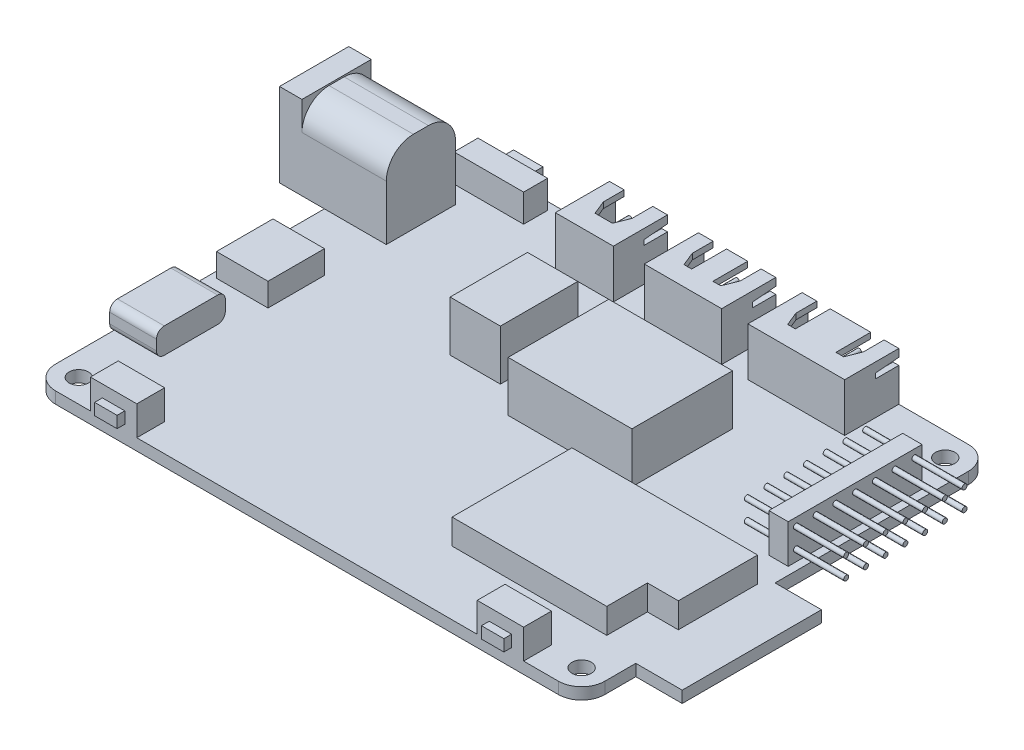
from build123d import *

# Parameters (mm, degrees)
SKETCH_2_W                  = 71
SKETCH_2_H                  = 53
SKETCH_2_W_2                = 6
SKETCH_2_H_2                = 18
EXTRUDE_1_DEPTH             = 1.5
FILLET_1_R                  = 3
SKETCH_3_W                  = 10
SKETCH_3_H                  = 7
SKETCH_3_W_2                = 12.5
SKETCH_3_W_3                = 7.5
EXTRUDE_2_DEPTH             = 6.25
SKETCH_3_3_W                = 16
SKETCH_3_3_H                = 13
SKETCH_3_3_W_2              = 6.5
SKETCH_3_3_H_2              = 10
EXTRUDE_3_DEPTH             = 6.5
SKETCH_3_4_W                = 20
SKETCH_3_4_H                = 15.5
SKETCH_3_4_W_2              = 4
SKETCH_3_4_H_2              = 10.25
EXTRUDE_4_DEPTH             = 3.25
CUT_EXTRUDE_1_REACH         = 60.863
SKETCH_3_5_R                = 1.25
SKETCH_3_6_W                = 2.5
SKETCH_3_6_H                = 17.3
EXTRUDE_5_DEPTH             = 5
SKETCH_3_7_W                = 6.05
SKETCH_3_7_H                = 8.9
EXTRUDE_6_DEPTH             = 3.3
SKETCH_3_8_W                = 6
SKETCH_3_8_H                = 3.6
EXTRUDE_7_DEPTH             = 3.8
SKETCH_3_9_W                = 6.66
SKETCH_3_9_H                = 7.3
EXTRUDE_8_DEPTH             = 3
SKETCH_3_10_W               = 8
SKETCH_3_10_H               = 8.95
SKETCH_3_10_W_2             = 5.8
EXTRUDE_9_DEPTH             = 10.6
SKETCH_3_11_W               = 9
SKETCH_3_11_H               = 3.1
EXTRUDE_10_DEPTH            = 3.6
FILLET_2_R                  = 1
FILLET_3_R                  = 3.5
SKETCH_8_W                  = 8.95
SKETCH_8_H                  = 10.8
EXTRUDE_11_DEPTH            = 2.9
SKETCH_8_7_R                = 3
SKETCH_8_7_R_2              = 0.75
CUT_EXTRUDE_2_DEPTH         = 10
FILLET_6_R                  = 0.75
SKETCH_9_W                  = 2.9
SKETCH_9_H                  = 1.5
EXTRUDE_12_DEPTH            = 1
CUT_EXTRUDE_3_DEPTH         = 5
FILLET_7_R                  = 0.2
SKETCH_12_W                 = 8.5
SKETCH_12_H                 = 4.75
SKETCH_12_R                 = 0.3
SKETCH_12_W_2               = 6
SKETCH_12_W_3               = 11
CUT_EXTRUDE_4_DEPTH         = 5.5
CUT_EXTRUDE_5_DEPTH         = 40
SKETCH_14_W                 = 0.24
SKETCH_14_H                 = 4.5
CUT_EXTRUDE_6_DEPTH         = 0.75
EXTRUDE_START               = -6.35
SKETCH_16_R                 = 0.325
EXTRUDE_13_DEPTH            = 12.85
PATTERN_LINEAR_1_COUNT      = 7
PATTERN_LINEAR_1_PITCH      = 2.55
PATTERN_LINEAR_1_COUNT_DIR2 = 2
PATTERN_LINEAR_1_PITCH_DIR2 = 2.55
EXTRUDE_14_DEPTH            = 0.2
EXTRUDE_15_DEPTH            = 2.8
SKETCH_19_W                 = 3.8
SKETCH_19_H                 = 1.55
EXTRUDE_16_DEPTH            = 2


with BuildPart() as part:
    # 草图2 → 凸台-拉伸1 (new body)
    with BuildSketch(Plane(origin=(0, 0, 0), x_dir=(1, 0, 0), z_dir=(0, 1, 0))):
        with Locations((10.067073171, 1.131097561)):
            Rectangle(SKETCH_2_W, SKETCH_2_H)
        with Locations((48.567073171, -9.368902439)):
            Rectangle(SKETCH_2_W_2, SKETCH_2_H_2)
    extrude(amount=EXTRUDE_1_DEPTH)

    # 圆角1
    fillet_1_edges = [part.edges().sort_by_distance(p)[0] for p in [
        (45.567073171, 0.75, 25.368902439),
        (-25.432926829, 0.75, 25.368902439),
        (-25.432926829, 0.75, -27.631097561),
        (45.567073171, 0.75, -27.631097561),
    ]]
    fillet(fillet_1_edges, radius=FILLET_1_R)

    # 草图3 → 凸台-拉伸2 (add)
    with BuildSketch(Plane(origin=(0, 1.5, 0), x_dir=(1, 0, 0), z_dir=(0, 1, 0))):
        with Locations((12.667073171, 24.131097561)):
            Rectangle(SKETCH_3_W, SKETCH_3_H)
        with Locations((27.317073171, 24.131097561)):
            Rectangle(SKETCH_3_W_2, SKETCH_3_H)
        with Locations((-0.082926829, 24.131097561)):
            Rectangle(SKETCH_3_W_3, SKETCH_3_H)
    extrude(amount=EXTRUDE_2_DEPTH)

    # 草图3<3> → 凸台-拉伸3 (add)
    with BuildSketch(Plane(origin=(0, 1.5, 0), x_dir=(1, 0, 0), z_dir=(0, 1, 0))):
        with Locations((17.567073171, 7.631097561)):
            Rectangle(SKETCH_3_3_W, SKETCH_3_3_H)
        with Locations((2.317073171, 9.131097561)):
            Rectangle(SKETCH_3_3_W_2, SKETCH_3_3_H_2)
    extrude(amount=EXTRUDE_3_DEPTH)

    # 草图3<4> → 凸台-拉伸4 (add)
    with BuildSketch(Plane(origin=(0, 1.5, 0), x_dir=(1, 0, 0), z_dir=(0, 1, 0))):
        with Locations((30.567073171, -9.368902439)):
            Rectangle(SKETCH_3_4_W, SKETCH_3_4_H)
        with Locations((42.567073171, -6.743902439)):
            Rectangle(SKETCH_3_4_W_2, SKETCH_3_4_H_2)
    extrude(amount=EXTRUDE_4_DEPTH)

    # 草图3<5> → 切除-拉伸1 (cut, up to next)
    with BuildSketch(Plane(origin=(0, 1.5, 0), x_dir=(1, 0, 0), z_dir=(0, 1, 0)), mode=Mode.PRIVATE) as cut_extrude_1_sk1:
        with Locations(Location((-22.432926829, 24.631097561, 0), (0, 0, 270))):
            Circle(SKETCH_3_5_R)
    cut_extrude_1_tool1 = extrude(cut_extrude_1_sk1.sketch, amount=-CUT_EXTRUDE_1_REACH, mode=Mode.PRIVATE) & part.part
    # 草图3<5> → 切除-拉伸1 (cut, up to next)
    with BuildSketch(Plane(origin=(0, 1.5, 0), x_dir=(1, 0, 0), z_dir=(0, 1, 0)), mode=Mode.PRIVATE) as cut_extrude_1_sk2:
        with Locations(Location((42.567073171, 24.631097561, 0), (0, 0, 270))):
            Circle(SKETCH_3_5_R)
    cut_extrude_1_tool2 = extrude(cut_extrude_1_sk2.sketch, amount=-CUT_EXTRUDE_1_REACH, mode=Mode.PRIVATE) & part.part
    # 草图3<5> → 切除-拉伸1 (cut, up to next)
    with BuildSketch(Plane(origin=(0, 1.5, 0), x_dir=(1, 0, 0), z_dir=(0, 1, 0)), mode=Mode.PRIVATE) as cut_extrude_1_sk3:
        with Locations(Location((42.567073171, -22.368902439, 0), (0, 0, 270))):
            Circle(SKETCH_3_5_R)
    cut_extrude_1_tool3 = extrude(cut_extrude_1_sk3.sketch, amount=-CUT_EXTRUDE_1_REACH, mode=Mode.PRIVATE) & part.part
    # 草图3<5> → 切除-拉伸1 (cut, up to next)
    with BuildSketch(Plane(origin=(0, 1.5, 0), x_dir=(1, 0, 0), z_dir=(0, 1, 0)), mode=Mode.PRIVATE) as cut_extrude_1_sk4:
        with Locations(Location((-22.432926829, -22.368902439, 0), (0, 0, 270))):
            Circle(SKETCH_3_5_R)
    cut_extrude_1_tool4 = extrude(cut_extrude_1_sk4.sketch, amount=-CUT_EXTRUDE_1_REACH, mode=Mode.PRIVATE) & part.part
    add(cut_extrude_1_tool1.solids().sort_by_distance((-22.432927, 1.5, -24.631098))[0], mode=Mode.SUBTRACT)
    add(cut_extrude_1_tool2.solids().sort_by_distance((42.567073, 1.5, -24.631098))[0], mode=Mode.SUBTRACT)
    add(cut_extrude_1_tool3.solids().sort_by_distance((42.567073, 1.5, 22.368902))[0], mode=Mode.SUBTRACT)
    add(cut_extrude_1_tool4.solids().sort_by_distance((-22.432927, 1.5, 22.368902))[0], mode=Mode.SUBTRACT)

    # 草图3<6> → 凸台-拉伸5 (add)
    with BuildSketch(Plane(origin=(0, 1.5, 0), x_dir=(1, 0, 0), z_dir=(0, 1, 0))):
        with Locations((43.317073171, 10.981097561)):
            Rectangle(SKETCH_3_6_W, SKETCH_3_6_H)
    extrude(amount=EXTRUDE_5_DEPTH)

    # 草图3<8> → 凸台-拉伸7 (add)
    with BuildSketch(Plane(origin=(0, 1.5, 0), x_dir=(1, 0, 0), z_dir=(0, 1, 0))):
        with Locations((35.067073171, -23.568902439)):
            Rectangle(SKETCH_3_8_W, SKETCH_3_8_H)
        with Locations((-14.932926829, -23.568902439)):
            Rectangle(SKETCH_3_8_W, SKETCH_3_8_H)
    extrude(amount=EXTRUDE_7_DEPTH)

    # 草图3<9> → 凸台-拉伸8 (add)
    with BuildSketch(Plane(origin=(0, 1.5, 0), x_dir=(1, 0, 0), z_dir=(0, 1, 0))):
        with Locations((-21.302926829, 1.281097561)):
            Rectangle(SKETCH_3_9_W, SKETCH_3_9_H)
    extrude(amount=EXTRUDE_8_DEPTH)

    # 草图3<10> → 凸台-拉伸9 (add)
    with BuildSketch(Plane(origin=(0, 1.5, 0), x_dir=(1, 0, 0), z_dir=(0, 1, 0))):
        with Locations((-21.432926829, 16.856097561)):
            Rectangle(SKETCH_3_10_W, SKETCH_3_10_H)
        with Locations((-28.332926829, 16.856097561)):
            Rectangle(SKETCH_3_10_W_2, SKETCH_3_10_H)
    extrude(amount=EXTRUDE_9_DEPTH)

    # 草图3<11> → 凸台-拉伸10 (add)
    with BuildSketch(Plane(origin=(0, 1.5, 0), x_dir=(1, 0, 0), z_dir=(0, 1, 0))):
        with Locations((-15.332926829, 25.081097561)):
            Rectangle(SKETCH_3_11_W, SKETCH_3_11_H)
    extrude(amount=EXTRUDE_10_DEPTH)

    # 圆角3
    fillet_3_edges = [part.edges().sort_by_distance(p)[0] for p in [
        (-24.332926829, 12.1, -21.331097561),
        (-24.332926829, 12.1, -12.381097561),
    ]]
    fillet(fillet_3_edges, radius=FILLET_3_R)

    # 草图8 → 凸台-拉伸11 (add)
    with BuildSketch(Plane.ZY.offset(31.232926829)):
        with Locations((-16.856097561, 6.9)):
            Rectangle(SKETCH_8_W, SKETCH_8_H)
    extrude(amount=-EXTRUDE_11_DEPTH)

    # 草图8<7> → 切除-拉伸2 (cut)
    with BuildSketch(Plane.ZY.offset(31.232926829)):
        with Locations((-16.968920267, 8.6)):
            Circle(SKETCH_8_7_R)
        with Locations((-16.968920267, 8.6)):
            Circle(SKETCH_8_7_R_2, mode=Mode.SUBTRACT)
    extrude(amount=-CUT_EXTRUDE_2_DEPTH, mode=Mode.SUBTRACT)

    # 圆角6
    fillet_6_edges = [part.edges().sort_by_distance(p)[0] for p in [
        (-31.232926829, 8.6, -17.718920267),
    ]]
    fillet(fillet_6_edges, radius=FILLET_6_R)

    # 草图9 → 凸台-拉伸12 (add)
    with BuildSketch(Plane.XY.offset(25.368902439)):
        with Locations((-14.932926829, 2.98779605)):
            Rectangle(SKETCH_9_W, SKETCH_9_H)
        with Locations((35.067073171, 2.98779605)):
            Rectangle(SKETCH_9_W, SKETCH_9_H)
    extrude(amount=EXTRUDE_12_DEPTH)

    # 草图12 → 切除-拉伸4 (cut)
    # profile 1 of 3: a face of its own
    with BuildSketch(Plane(origin=(0, 0, -27.631097561), x_dir=(-1, 0, 0), z_dir=(0, 0, -1))):
        with Locations((-12.667073171, 4.625)):
            Rectangle(SKETCH_12_W, SKETCH_12_H)
        with Locations((-10.417073171, 4.908866713)):
            Circle(SKETCH_12_R, mode=Mode.SUBTRACT)
        with Locations((-12.667073171, 4.908866713)):
            Circle(SKETCH_12_R, mode=Mode.SUBTRACT)
        with Locations((-14.917073171, 4.908866713)):
            Circle(SKETCH_12_R, mode=Mode.SUBTRACT)
    # profile 2 of 3: a face of its own
    with BuildSketch(Plane(origin=(0, 0, -27.631097561), x_dir=(-1, 0, 0), z_dir=(0, 0, -1))):
        with Locations((0.082926829, 4.625)):
            Rectangle(SKETCH_12_W_2, SKETCH_12_H)
        with Locations((1.207926829, 4.908866713)):
            Circle(SKETCH_12_R, mode=Mode.SUBTRACT)
        with Locations((-1.042073171, 4.908866713)):
            Circle(SKETCH_12_R, mode=Mode.SUBTRACT)
    # profile 3 of 3: a face of its own
    with BuildSketch(Plane(origin=(0, 0, -27.631097561), x_dir=(-1, 0, 0), z_dir=(0, 0, -1))):
        with Locations((-27.317073171, 4.625)):
            Rectangle(SKETCH_12_W_3, SKETCH_12_H)
        with Locations((-23.942073171, 4.908866713)):
            Circle(SKETCH_12_R, mode=Mode.SUBTRACT)
        with Locations((-26.192073171, 4.908866713)):
            Circle(SKETCH_12_R, mode=Mode.SUBTRACT)
        with Locations((-28.442073171, 4.908866713)):
            Circle(SKETCH_12_R, mode=Mode.SUBTRACT)
        with Locations((-30.6920557, 4.9)):
            Circle(SKETCH_12_R, mode=Mode.SUBTRACT)
    extrude(amount=-CUT_EXTRUDE_4_DEPTH, mode=Mode.SUBTRACT)

    # 草图13 → 切除-拉伸5 (cut)
    with BuildSketch(Plane(origin=(33.567073171, 0, 0), x_dir=(0, 0, -1), z_dir=(1, 0, 0))):
        Polygon((27.631097561, 6.75), (24.598394914, 6.5), (24.598394914, 5.85), (27.631097561, 5.85), align=None)
    extrude(amount=-CUT_EXTRUDE_5_DEPTH, mode=Mode.SUBTRACT)

    # 草图14 → 切除-拉伸6 (cut)
    with BuildSketch(Plane(origin=(0, 7.75, 0), x_dir=(1, 0, 0), z_dir=(0, 1, 0))):
        Polygon((0.037073171, 27.631097561), (1.767073171, 27.631097561), (1.767073171, 24.931097561), (1.037073171, 23.131097561), (0.037073171, 23.131097561), align=None)
        Polygon((-0.202926829, 27.631097561), (-0.202926829, 23.131097561), (-1.202926829, 23.131097561), (-1.932926829, 24.931097561), (-1.932926829, 27.631097561), align=None)
        with Locations((-0.082926829, 25.381097561)):
            Rectangle(SKETCH_14_W, SKETCH_14_H)
        Polygon((11.297073171, 27.631097561), (11.297073171, 23.131097561), (10.297073171, 23.131097561), (9.567073171, 24.931097561), (9.567073171, 27.631097561), align=None)
        Polygon((14.037073171, 27.631097561), (15.767073171, 27.631097561), (15.767073171, 24.931097561), (15.037073171, 23.131097561), (14.037073171, 23.131097561), align=None)
        Polygon((24.697073171, 23.131097561), (24.697073171, 27.631097561), (22.967073171, 27.631097561), (22.967073171, 24.931097561), (23.697073171, 23.131097561), align=None)
        Polygon((31.667073171, 27.631097561), (29.937073171, 27.631097561), (29.937073171, 23.131097561), (30.937073171, 23.131097561), (31.667073171, 24.931097561), align=None)
    extrude(amount=-CUT_EXTRUDE_6_DEPTH, mode=Mode.SUBTRACT)

    # 草图18 → 凸台-拉伸14 (add)
    with BuildSketch(Plane.XZ):
        with BuildLine():
            Line((14.567073171, 17.943902439), (10.506349221, 17.943902439))
            ThreePointArc((10.506349221, 17.943902439), (10.794895664, 16.873371538), (10.892073171, 15.768902439))
            ThreePointArc((10.892073171, 15.768902439), (10.794895664, 14.66443334), (10.506349221, 13.593902439))
            Line((10.506349221, 13.593902439), (14.567073171, 13.593902439))
            Line((14.567073171, 13.593902439), (14.567073171, 17.943902439))
        make_face()
        with BuildLine():
            Line((-1.372202879, 17.943902439), (-5.432926829, 17.943902439))
            Line((-5.432926829, 17.943902439), (-5.432926829, 13.593902439))
            Line((-5.432926829, 13.593902439), (-1.372202879, 13.593902439))
            ThreePointArc((-1.372202879, 13.593902439), (-1.757926829, 15.768902439), (-1.372202879, 17.943902439))
        make_face()
        with BuildLine():
            Line((10.506349221, 17.943902439), (-1.372202879, 17.943902439))
            ThreePointArc((-1.372202879, 17.943902439), (-1.757926829, 15.768902439), (-1.372202879, 13.593902439))
            Line((-1.372202879, 13.593902439), (10.506349221, 13.593902439))
            ThreePointArc((10.506349221, 13.593902439), (10.794895664, 14.66443334), (10.892073171, 15.768902439))
            ThreePointArc((10.892073171, 15.768902439), (10.794895664, 16.873371538), (10.506349221, 17.943902439))
        make_face()
    extrude(amount=EXTRUDE_14_DEPTH)

    # 草图18<3> → 凸台-拉伸15 (add)
    with BuildSketch(Plane.XZ):
        with BuildLine():
            ThreePointArc((10.506349221, 17.943902439), (4.567073171, 22.093902439), (-1.372202879, 17.943902439))
            Line((-1.372202879, 17.943902439), (10.506349221, 17.943902439))
        make_face()
        with BuildLine():
            Line((10.506349221, 13.593902439), (-1.372202879, 13.593902439))
            ThreePointArc((-1.372202879, 13.593902439), (4.567073171, 9.443902439), (10.506349221, 13.593902439))
        make_face()
        with BuildLine():
            Line((10.506349221, 17.943902439), (-1.372202879, 17.943902439))
            ThreePointArc((-1.372202879, 17.943902439), (-1.757926829, 15.768902439), (-1.372202879, 13.593902439))
            Line((-1.372202879, 13.593902439), (10.506349221, 13.593902439))
            ThreePointArc((10.506349221, 13.593902439), (10.794895664, 14.66443334), (10.892073171, 15.768902439))
            ThreePointArc((10.892073171, 15.768902439), (10.794895664, 16.873371538), (10.506349221, 17.943902439))
        make_face()
    extrude(amount=EXTRUDE_15_DEPTH)

    # 草图19 → 凸台-拉伸16 (add)
    with BuildSketch(Plane(origin=(0, 0, -26.631097561), x_dir=(-1, 0, 0), z_dir=(0, 0, -1))):
        with Locations((15.332926829, 3.3)):
            Rectangle(SKETCH_19_W, SKETCH_19_H)
    extrude(amount=EXTRUDE_16_DEPTH)


with BuildPart() as body_2:
    # 草图3<7> → 凸台-拉伸6 (new body)
    with BuildSketch(Plane(origin=(0, 1.5, 0), x_dir=(1, 0, 0), z_dir=(0, 1, 0))):
        with Locations((-22.407926829, -10.918902439)):
            Rectangle(SKETCH_3_7_W, SKETCH_3_7_H)
    extrude(amount=EXTRUDE_6_DEPTH)

    # 圆角2
    fillet_2_edges = [body_2.edges().sort_by_distance(p)[0] for p in [
        (-22.407926829, 4.8, 15.368902439),
        (-22.407926829, 1.5, 15.368902439),
        (-22.407926829, 1.5, 6.468902439),
        (-22.407926829, 4.8, 6.468902439),
    ]]
    fillet(fillet_2_edges, radius=FILLET_2_R)

    # 草图10 → 切除-拉伸3 (cut)
    with BuildSketch(Plane.ZY.offset(25.432926829)):
        with BuildLine():
            Line((7.368902439, 4.5), (14.468902439, 4.5))
            ThreePointArc((14.468902439, 4.5), (14.893166508, 4.324264069), (15.068902439, 3.9))
            Line((15.068902439, 3.9), (15.068902439, 2.4))
            ThreePointArc((15.068902439, 2.4), (14.893166508, 1.975735931), (14.468902439, 1.8))
            Line((14.468902439, 1.8), (7.368902439, 1.8))
            ThreePointArc((7.368902439, 1.8), (6.94463837, 1.975735931), (6.768902439, 2.4))
            Line((6.768902439, 2.4), (6.768902439, 3.9))
            ThreePointArc((6.768902439, 3.9), (6.94463837, 4.324264069), (7.368902439, 4.5))
        make_face()
        with BuildLine():
            Line((7.968902439, 3.45), (13.868902439, 3.45))
            ThreePointArc((13.868902439, 3.45), (14.010323795, 3.391421356), (14.068902439, 3.25))
            Line((14.068902439, 3.25), (14.068902439, 3.05))
            ThreePointArc((14.068902439, 3.05), (14.010323795, 2.908578644), (13.868902439, 2.85))
            Line((13.868902439, 2.85), (7.968902439, 2.85))
            ThreePointArc((7.968902439, 2.85), (7.827481083, 2.908578644), (7.768902439, 3.05))
            Line((7.768902439, 3.05), (7.768902439, 3.25))
            ThreePointArc((7.768902439, 3.25), (7.827481083, 3.391421356), (7.968902439, 3.45))
        make_face(mode=Mode.SUBTRACT)
    extrude(amount=-CUT_EXTRUDE_3_DEPTH, mode=Mode.SUBTRACT)

    # 圆角7
    fillet_7_edges = [body_2.edges().sort_by_distance(p)[0] for p in [
        (-25.432926829, 2.908578644, 14.010323795),
        (-25.432926829, 2.85, 10.918902439),
        (-25.432926829, 2.908578644, 7.827481083),
        (-25.432926829, 3.15, 7.768902439),
        (-25.432926829, 3.391421356, 7.827481083),
        (-25.432926829, 3.45, 10.918902439),
        (-25.432926829, 3.391421356, 14.010323795),
        (-25.432926829, 3.15, 14.068902439),
    ]]
    fillet(fillet_7_edges, radius=FILLET_7_R)


with BuildPart() as body_3:
    # 草图16 → 凸台-拉伸13 (new body)
    with BuildSketch(Plane(origin=(44.567073171, 0, 0), x_dir=(0, 0, -1), z_dir=(1, 0, 0)).offset(EXTRUDE_START)):
        with Locations((3.331097561, 5.5)):
            Circle(SKETCH_16_R)
    extrude_13 = extrude(amount=EXTRUDE_13_DEPTH)


with BuildPart() as pattern_linear_1_1:
    # 阵列(线性)1: Extrude 13 7 × 2
    with Locations(*[(0, -j * PATTERN_LINEAR_1_PITCH_DIR2, -i * PATTERN_LINEAR_1_PITCH) for i in range(PATTERN_LINEAR_1_COUNT) for j in range(PATTERN_LINEAR_1_COUNT_DIR2) if (i, j) != (0, 0)]):
        add(extrude_13)


solid = Compound([part.part, body_2.part, body_3.part, pattern_linear_1_1.part])
